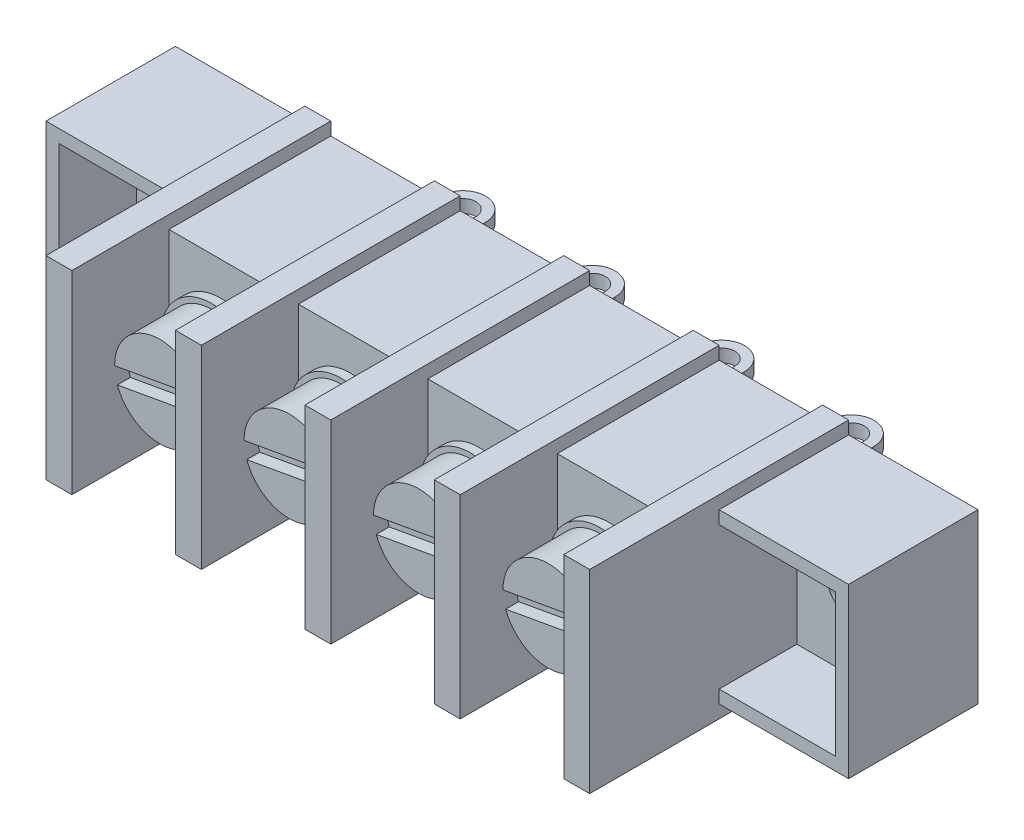
from build123d import *

# Parameters (mm, degrees)
SKETCH_1_W             = 82
SKETCH_1_H             = 15
EXTRUDE_1_DEPTH        = 10
SKETCH_2_W             = 2
SKETCH_2_H             = 15
EXTRUDE_2_DEPTH        = 10
SKETCH_3_W             = 8
SKETCH_3_H             = 15
EXTRUDE_3_DEPTH        = 2.5
SKETCH_4_R             = 3.9
EXTRUDE_4_DEPTH        = 0.7
SKETCH_6_R             = 3.5
EXTRUDE_5_DEPTH        = 4
CUT_EXTRUDE_START      = -1
CUT_EXTRUDE_1_DEPTH    = 1
SKETCH_8_W             = 3.5
SKETCH_8_H             = 1
EXTRUDE_6_DEPTH        = 8
SKETCH_10_W            = 10
SKETCH_10_H            = 15
EXTRUDE_7_DEPTH        = 10
SKETCH_11_W            = 10
SKETCH_11_H            = 15
EXTRUDE_8_DEPTH        = 10
SKETCH_12_R            = 1.6
CUT_EXTRUDE_2_DEPTH    = 10
SKETCH_13_W            = 9
SKETCH_13_H            = 11
CUT_EXTRUDE_3_DEPTH    = 6
SKETCH_14_W            = 8
SKETCH_14_H            = 1
SKETCH_14_W_2          = 10
CUT_EXTRUDE_4_DEPTH    = 20
CUT_EXTRUDE_5_DEPTH    = 20
PATTERN_LINEAR_1_COUNT = 8
PATTERN_LINEAR_1_PITCH = 10
CUT_EXTRUDE_6_DEPTH    = 20
CUT_EXTRUDE_7_DEPTH    = 20
CUT_EXTRUDE_8_DEPTH    = 10
SKETCH_19_R            = 1.6
CUT_EXTRUDE_9_DEPTH    = 10
SKETCH_20_W            = 1
SKETCH_20_H            = 13
EXTRUDE_9_DEPTH        = 6
SKETCH_21_W            = 10
SKETCH_21_H            = 13
CUT_EXTRUDE_10_DEPTH   = 20
SKETCH_22_W            = 10
SKETCH_22_H            = 13
CUT_EXTRUDE_11_DEPTH   = 20


with BuildPart() as part:
    # Эскиз1 → Вытянуть1 (new body)
    with BuildSketch(Plane.XY):
        Rectangle(SKETCH_1_W, SKETCH_1_H)
    extrude(amount=EXTRUDE_1_DEPTH)

    # Эскиз2 → Вытянуть2 (add)
    with BuildSketch(Plane.XY.offset(10)):
        with Locations((-40, 0)):
            Rectangle(SKETCH_2_W, SKETCH_2_H)
        with Locations((-30, 0)):
            Rectangle(SKETCH_2_W, SKETCH_2_H)
        Rectangle(SKETCH_2_W, SKETCH_2_H)
        with Locations((30, 0)):
            Rectangle(SKETCH_2_W, SKETCH_2_H)
        with Locations((40, 0)):
            Rectangle(SKETCH_2_W, SKETCH_2_H)
        with Locations((-20, 0)):
            Rectangle(SKETCH_2_W, SKETCH_2_H)
        with Locations((10, 0)):
            Rectangle(SKETCH_2_W, SKETCH_2_H)
        with Locations((-10, 0)):
            Rectangle(SKETCH_2_W, SKETCH_2_H)
        with Locations((20, 0)):
            Rectangle(SKETCH_2_W, SKETCH_2_H)
    extrude(amount=EXTRUDE_2_DEPTH)

    # Эскиз3 → Вытянуть3 (add)
    with BuildSketch(Plane.XY.offset(10)):
        with Locations((-35, 0)):
            Rectangle(SKETCH_3_W, SKETCH_3_H)
        with Locations((-25, 0)):
            Rectangle(SKETCH_3_W, SKETCH_3_H)
        with Locations((-15, 0)):
            Rectangle(SKETCH_3_W, SKETCH_3_H)
        with Locations((-5, 0)):
            Rectangle(SKETCH_3_W, SKETCH_3_H)
        with Locations((5, 0)):
            Rectangle(SKETCH_3_W, SKETCH_3_H)
        with Locations((15, 0)):
            Rectangle(SKETCH_3_W, SKETCH_3_H)
        with Locations((25, 0)):
            Rectangle(SKETCH_3_W, SKETCH_3_H)
        with Locations((35, 0)):
            Rectangle(SKETCH_3_W, SKETCH_3_H)
    extrude(amount=EXTRUDE_3_DEPTH)

    # Эскиз4 → Вытянуть4 (add)
    with BuildSketch(Plane.XY.offset(12.5)):
        with Locations(Location((-35, 0, 0), (0, 0, 180))):
            Circle(SKETCH_4_R)
        with Locations((-25, 0)):
            Circle(SKETCH_4_R)
        with Locations((-15, 0)):
            Circle(SKETCH_4_R)
        with Locations((-5, 0)):
            Circle(SKETCH_4_R)
        with Locations(Location((5, 0, 0), (0, 0, 180))):
            Circle(SKETCH_4_R)
        with Locations(Location((15, 0, 0), (0, 0, 180))):
            Circle(SKETCH_4_R)
        with Locations(Location((25, 0, 0), (0, 0, 180))):
            Circle(SKETCH_4_R)
        with Locations(Location((35, 0, 0), (0, 0, 180))):
            Circle(SKETCH_4_R)
    extrude(amount=EXTRUDE_4_DEPTH)

    # Эскиз6 → Вытянуть5 (add)
    with BuildSketch(Plane.XY.offset(13.2)):
        with Locations((-35, 0)):
            Circle(SKETCH_6_R)
        with Locations((-25, 0)):
            Circle(SKETCH_6_R)
        with Locations((-15, 0)):
            Circle(SKETCH_6_R)
        with Locations((-5, 0)):
            Circle(SKETCH_6_R)
        with Locations(Location((5, 0, 0), (0, 0, 180))):
            Circle(SKETCH_6_R)
        with Locations(Location((15, 0, 0), (0, 0, 180))):
            Circle(SKETCH_6_R)
        with Locations(Location((25, 0, 0), (0, 0, 180))):
            Circle(SKETCH_6_R)
        with Locations(Location((35, 0, 0), (0, 0, 180))):
            Circle(SKETCH_6_R)
    extrude(amount=EXTRUDE_5_DEPTH)

    # Эскиз7 → Вырез-Вытянуть1 (cut)
    with BuildSketch(Plane.XY.offset(17.2).offset(CUT_EXTRUDE_START)):
        with BuildLine():
            Line((-31.711388315, 1.197928706), (-38.49996022, -0.016687072))
            ThreePointArc((-38.49996022, -0.016687072), (-38.445288098, -0.616433226), (-38.288611685, -1.197928706))
            Line((-38.288611685, -1.197928706), (-31.50003978, 0.016687072))
            ThreePointArc((-31.50003978, 0.016687072), (-31.554711902, 0.616433226), (-31.711388315, 1.197928706))
        make_face()
        with BuildLine():
            Line((-21.711388315, 1.197928706), (-28.49996022, -0.016687072))
            ThreePointArc((-28.49996022, -0.016687072), (-28.445288098, -0.616433226), (-28.288611685, -1.197928706))
            Line((-28.288611685, -1.197928706), (-21.50003978, 0.016687072))
            ThreePointArc((-21.50003978, 0.016687072), (-21.554711902, 0.616433226), (-21.711388315, 1.197928706))
        make_face()
        with BuildLine():
            Line((-11.711388315, 1.197928706), (-18.49996022, -0.016687072))
            ThreePointArc((-18.49996022, -0.016687072), (-18.445288098, -0.616433226), (-18.288611685, -1.197928706))
            Line((-18.288611685, -1.197928706), (-11.50003978, 0.016687072))
            ThreePointArc((-11.50003978, 0.016687072), (-11.554711902, 0.616433226), (-11.711388315, 1.197928706))
        make_face()
        with BuildLine():
            Line((-1.711388315, 1.197928706), (-8.49996022, -0.016687072))
            ThreePointArc((-8.49996022, -0.016687072), (-8.445288098, -0.616433226), (-8.288611685, -1.197928706))
            Line((-8.288611685, -1.197928706), (-1.50003978, 0.016687072))
            ThreePointArc((-1.50003978, 0.016687072), (-1.554711902, 0.616433226), (-1.711388315, 1.197928706))
        make_face()
        with BuildLine():
            Line((8.288611685, 1.197928706), (1.50003978, -0.016687072))
            ThreePointArc((1.50003978, -0.016687072), (1.554711902, -0.616433226), (1.711388315, -1.197928706))
            Line((1.711388315, -1.197928706), (8.49996022, 0.016687072))
            ThreePointArc((8.49996022, 0.016687072), (8.445288098, 0.616433226), (8.288611685, 1.197928706))
        make_face()
        with BuildLine():
            Line((18.288611685, 1.197928706), (11.50003978, -0.016687072))
            ThreePointArc((11.50003978, -0.016687072), (11.554711902, -0.616433226), (11.711388315, -1.197928706))
            Line((11.711388315, -1.197928706), (18.49996022, 0.016687072))
            ThreePointArc((18.49996022, 0.016687072), (18.445288098, 0.616433226), (18.288611685, 1.197928706))
        make_face()
        with BuildLine():
            Line((28.288611685, 1.197928706), (21.50003978, -0.016687072))
            ThreePointArc((21.50003978, -0.016687072), (21.554711902, -0.616433226), (21.711388315, -1.197928706))
            Line((21.711388315, -1.197928706), (28.49996022, 0.016687072))
            ThreePointArc((28.49996022, 0.016687072), (28.445288098, 0.616433226), (28.288611685, 1.197928706))
        make_face()
        with BuildLine():
            Line((38.288611685, 1.197928706), (31.50003978, -0.016687072))
            ThreePointArc((31.50003978, -0.016687072), (31.554711902, -0.616433226), (31.711388315, -1.197928706))
            Line((31.711388315, -1.197928706), (38.49996022, 0.016687072))
            ThreePointArc((38.49996022, 0.016687072), (38.445288098, 0.616433226), (38.288611685, 1.197928706))
        make_face()
    extrude(amount=CUT_EXTRUDE_1_DEPTH, mode=Mode.SUBTRACT)

    # Эскиз8 → Вытянуть6 (add)
    with BuildSketch(Plane(origin=(0, 0, 0), x_dir=(-1, 0, 0), z_dir=(0, 0, -1))):
        with Locations((25, 0)):
            Rectangle(SKETCH_8_W, SKETCH_8_H)
        with Locations((15, 0)):
            Rectangle(SKETCH_8_W, SKETCH_8_H)
        with Locations((5, 0)):
            Rectangle(SKETCH_8_W, SKETCH_8_H)
        with Locations((-5, 0)):
            Rectangle(SKETCH_8_W, SKETCH_8_H)
        with Locations((-15, 0)):
            Rectangle(SKETCH_8_W, SKETCH_8_H)
        with Locations((-25, 0)):
            Rectangle(SKETCH_8_W, SKETCH_8_H)
        with Locations((-35, 0)):
            Rectangle(SKETCH_8_W, SKETCH_8_H)
        with Locations((35, 0)):
            Rectangle(SKETCH_8_W, SKETCH_8_H)
    extrude(amount=EXTRUDE_6_DEPTH)

    # Эскиз10 → Вытянуть7 (add)
    with BuildSketch(Plane.ZY.offset(41)):
        with Locations((5, 0)):
            Rectangle(SKETCH_10_W, SKETCH_10_H)
    extrude(amount=EXTRUDE_7_DEPTH)

    # Эскиз11 → Вытянуть8 (add)
    with BuildSketch(Plane(origin=(41, 0, 0), x_dir=(0, 0, -1), z_dir=(1, 0, 0))):
        with Locations((-5, 0)):
            Rectangle(SKETCH_11_W, SKETCH_11_H)
    extrude(amount=EXTRUDE_8_DEPTH)

    # Эскиз12 → Вырез-Вытянуть2 (cut)
    with BuildSketch(Plane.XY.offset(10)):
        with Locations((45, 0)):
            Circle(SKETCH_12_R)
        with Locations(Location((-45, 0, 0), (0, 0, 180))):
            Circle(SKETCH_12_R)
    extrude(amount=-CUT_EXTRUDE_2_DEPTH, mode=Mode.SUBTRACT)

    # Эскиз13 → Вырез-Вытянуть3 (cut)
    with BuildSketch(Plane.XY.offset(10)):
        with Locations((45.5, 0)):
            Rectangle(SKETCH_13_W, SKETCH_13_H)
        with Locations((-45.5, 0)):
            Rectangle(SKETCH_13_W, SKETCH_13_H)
    extrude(amount=-CUT_EXTRUDE_3_DEPTH, mode=Mode.SUBTRACT)

    # Эскиз14 → Вырез-Вытянуть4 (cut)
    with BuildSketch(Plane.XY.offset(12.5)):
        with Locations((35, 7)):
            Rectangle(SKETCH_14_W, SKETCH_14_H)
        with Locations((46, 7)):
            Rectangle(SKETCH_14_W_2, SKETCH_14_H)
        with Locations((46, -7)):
            Rectangle(SKETCH_14_W_2, SKETCH_14_H)
        with Locations((35, -7)):
            Rectangle(SKETCH_14_W, SKETCH_14_H)
        with Locations((25, 7)):
            Rectangle(SKETCH_14_W, SKETCH_14_H)
        with Locations((25, -7)):
            Rectangle(SKETCH_14_W, SKETCH_14_H)
        with Locations((15, 7)):
            Rectangle(SKETCH_14_W, SKETCH_14_H)
        with Locations((15, -7)):
            Rectangle(SKETCH_14_W, SKETCH_14_H)
        with Locations((5, 7)):
            Rectangle(SKETCH_14_W, SKETCH_14_H)
        with Locations((5, -7)):
            Rectangle(SKETCH_14_W, SKETCH_14_H)
        with Locations((-5, 7)):
            Rectangle(SKETCH_14_W, SKETCH_14_H)
        with Locations((-5, -7)):
            Rectangle(SKETCH_14_W, SKETCH_14_H)
        with Locations((-15, 7)):
            Rectangle(SKETCH_14_W, SKETCH_14_H)
        with Locations((-15, -7)):
            Rectangle(SKETCH_14_W, SKETCH_14_H)
        with Locations((-25, 7)):
            Rectangle(SKETCH_14_W, SKETCH_14_H)
        with Locations((-25, -7)):
            Rectangle(SKETCH_14_W, SKETCH_14_H)
        with Locations((-35, 7)):
            Rectangle(SKETCH_14_W, SKETCH_14_H)
        with Locations((-35, -7)):
            Rectangle(SKETCH_14_W, SKETCH_14_H)
        with Locations((-46, -7)):
            Rectangle(SKETCH_14_W_2, SKETCH_14_H)
        with Locations((-46, 7)):
            Rectangle(SKETCH_14_W_2, SKETCH_14_H)
    extrude(amount=-CUT_EXTRUDE_4_DEPTH, mode=Mode.SUBTRACT)

    # Эскиз15 → Вырез-Вытянуть5 (cut)
    with BuildSketch(Plane.XZ.offset(0.5)):
        with BuildLine():
            Line((33.25, -6.212418118), (33.25, -10.544797806))
            Line((33.25, -10.544797806), (36.75, -10.544797806))
            Line((36.75, -10.544797806), (36.75, -6.212418118))
            ThreePointArc((36.75, -6.212418118), (35, -7.962418118), (33.25, -6.212418118))
        make_face()
        with BuildLine():
            Line((34, -6.212418118), (34, -5.812418118))
            ThreePointArc((34, -5.812418118), (35, -4.812418118), (36, -5.812418118))
            Line((36, -5.812418118), (36, -6.212418118))
            ThreePointArc((36, -6.212418118), (35, -7.212418118), (34, -6.212418118))
        make_face()
    cut_extrude_5 = extrude(amount=-CUT_EXTRUDE_5_DEPTH, mode=Mode.SUBTRACT)

    # Линейный массив1: Вырез-Вытянуть5 ×8
    with Locations(*[(-i * PATTERN_LINEAR_1_PITCH, 0, 0) for i in range(1, PATTERN_LINEAR_1_COUNT)]):
        add(cut_extrude_5, mode=Mode.SUBTRACT)

    # Эскиз16 → Вырез-Вытянуть6 (cut)
    with BuildSketch(Plane.ZY.offset(41)):
        Polygon((0, 6.5), (10, 6.5), (10, 5.5), (4, 5.5), (4, -5.5), (10, -5.5), (10, -6.5), (0, -6.5), (0, -7.5), (20, -7.5), (20, 7.5), (0, 7.5), align=None)
    extrude(amount=-CUT_EXTRUDE_6_DEPTH, mode=Mode.SUBTRACT)

    # Эскиз17 → Вырез-Вытянуть7 (cut)
    with BuildSketch(Plane(origin=(41, 0, 0), x_dir=(0, 0, -1), z_dir=(1, 0, 0))):
        Polygon((0, -6.5), (-10, -6.5), (-10, -5.5), (-4, -5.5), (-4, 5.5), (-10, 5.5), (-10, 6.5), (0, 6.5), (0, 7.5), (-20, 7.5), (-20, -7.5), (0, -7.5), align=None)
    extrude(amount=-CUT_EXTRUDE_7_DEPTH, mode=Mode.SUBTRACT)

    # Эскиз18 → Вырез-Вытянуть8 (cut)
    with BuildSketch(Plane.XZ.offset(0.5)):
        with BuildLine():
            Line((-26.75, 0), (-26.75, -6.212418118))
            ThreePointArc((-26.75, -6.212418118), (-25, -7.962418118), (-23.25, -6.212418118))
            Line((-23.25, -6.212418118), (-23.25, 0))
            Line((-23.25, 0), (-26.75, 0))
        make_face()
        with BuildLine():
            Line((-36.75, 0), (-36.75, -6.212418118))
            ThreePointArc((-36.75, -6.212418118), (-35, -7.962418118), (-33.25, -6.212418118))
            Line((-33.25, -6.212418118), (-33.25, 0))
            Line((-33.25, 0), (-36.75, 0))
        make_face()
        with BuildLine():
            Line((23.25, 0), (23.25, -6.212418118))
            ThreePointArc((23.25, -6.212418118), (25, -7.962418118), (26.75, -6.212418118))
            Line((26.75, -6.212418118), (26.75, 0))
            Line((26.75, 0), (23.25, 0))
        make_face()
        with BuildLine():
            Line((33.25, 0), (33.25, -6.212418118))
            ThreePointArc((33.25, -6.212418118), (35, -7.962418118), (36.75, -6.212418118))
            Line((36.75, -6.212418118), (36.75, 0))
            Line((36.75, 0), (33.25, 0))
        make_face()
    extrude(amount=-CUT_EXTRUDE_8_DEPTH, mode=Mode.SUBTRACT)

    # Эскиз19 → Вырез-Вытянуть9 (cut)
    with BuildSketch(Plane.XY.offset(4)):
        with Locations((-25, 0)):
            Circle(SKETCH_19_R)
        with Locations((25, 0)):
            Circle(SKETCH_19_R)
    extrude(amount=-CUT_EXTRUDE_9_DEPTH, mode=Mode.SUBTRACT)

    # Эскиз20 → Вытянуть9 (add)
    with BuildSketch(Plane.XY.offset(4)):
        with Locations((-30.5, 0)):
            Rectangle(SKETCH_20_W, SKETCH_20_H)
        with Locations((30.5, 0)):
            Rectangle(SKETCH_20_W, SKETCH_20_H)
    extrude(amount=EXTRUDE_9_DEPTH)

    # Эскиз21 → Вырез-Вытянуть10 (cut)
    with BuildSketch(Plane.ZY.offset(51)):
        with Locations((5, 0)):
            Rectangle(SKETCH_21_W, SKETCH_21_H)
    extrude(amount=-CUT_EXTRUDE_10_DEPTH, mode=Mode.SUBTRACT)

    # Эскиз22 → Вырез-Вытянуть11 (cut)
    with BuildSketch(Plane(origin=(51, 0, 0), x_dir=(0, 0, -1), z_dir=(1, 0, 0))):
        with Locations((-5, 0)):
            Rectangle(SKETCH_22_W, SKETCH_22_H)
    extrude(amount=-CUT_EXTRUDE_11_DEPTH, mode=Mode.SUBTRACT)


solid = part.part
